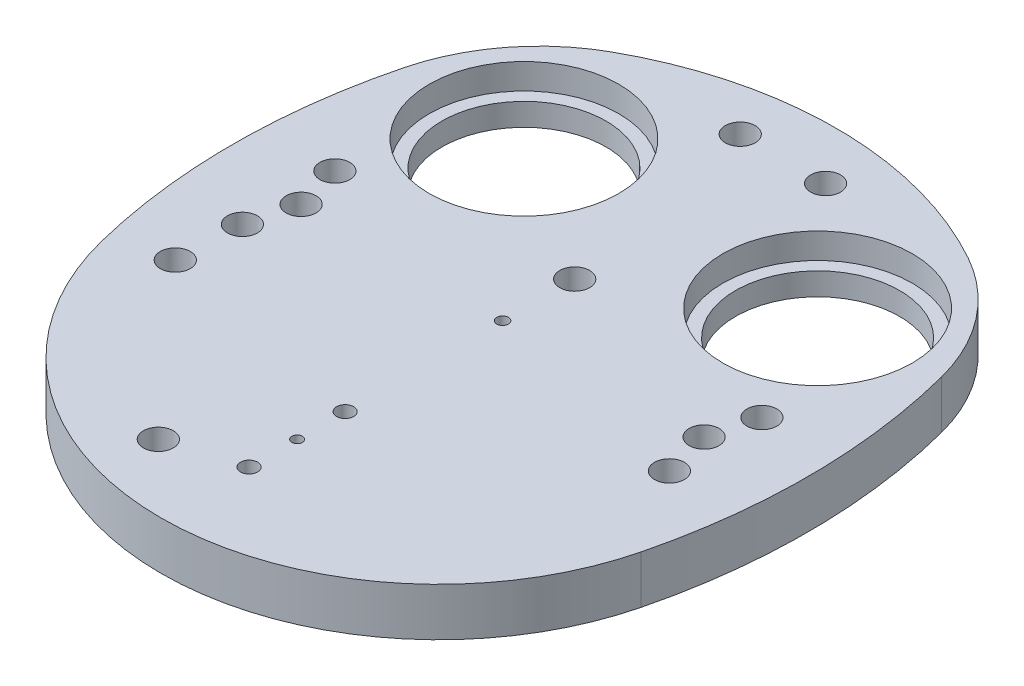
from build123d import *

# Parameters (mm, degrees)
SKETCH1_R                     = 20
SKETCH1_R_2                   = 17.75
BOSS_EXTRUDE1_DEPTH           = 9
SKETCH2_R                     = 17.75
SKETCH2_R_2                   = 15.375
BOSS_EXTRUDE3_DEPTH           = 4.215
SKETCH4_R                     = 2.8
M3_TAPPING_INSERT_HOLES_DEPTH = 7
EXTRUDE_THIN2_START           = -9
EXTRUDE_THIN2_DEPTH           = 9
THUMB_KNUCKLE_HOLE_START      = -4.5875
SKETCH7_R                     = 15.25
THUMB_KNUCKLE_HOLE_DEPTH      = 106.441707798
SKETCH8_R                     = 1
SKETCH8_R_2                   = 1.6
THUMB_THROUGH_HOLE_S_DEPTH    = 111.029207798
SKETCH9_R                     = 1.1
CENTER_SCREW_THROUGH_DEPTH    = 111.029207798


with BuildPart() as part:
    # Sketch1 → Boss-Extrude1 (new body)
    # profile 1 of 3: a face of its own
    with BuildSketch(Plane(origin=(0, 0, 0), x_dir=(1, 0, 0), z_dir=(0, 1, 0))):
        with BuildLine():
            ThreePointArc((46.554987721, 6.075149623), (47.262334812, 3.074105201), (47.5, 0))
            ThreePointArc((47.5, 0), (9.667891023, -9.056262443), (39.298411056, 16.149225881))
            ThreePointArc((39.298411056, 16.149225881), (0, 28.975470321), (-39.298411056, 16.149225881))
            ThreePointArc((-39.298411056, 16.149225881), (-18.443737557, 17.832108977), (-7.5, 0))
            ThreePointArc((-7.5, 0), (-30.574105201, -19.762334812), (-46.554987721, 6.075149623))
            ThreePointArc((-46.554987721, 6.075149623), (-51.83640533, -24.60085732), (-48.549912051, -55.554205053))
            ThreePointArc((-48.549912051, -55.554205053), (0, -93.502323139), (48.549912051, -55.554205053))
            ThreePointArc((48.549912051, -55.554205053), (51.83640533, -24.60085732), (46.554987721, 6.075149623))
        make_face()
    # profile 2 of 3: a face of its own
    with BuildSketch(Plane(origin=(0, 0, 0), x_dir=(1, 0, 0), z_dir=(0, 1, 0))):
        with Locations((-27.5, 0)):
            Circle(SKETCH1_R)
        with Locations(Location((-27.5, 0, 0), (0, 0, 270))):
            Circle(SKETCH1_R_2, mode=Mode.SUBTRACT)
    # profile 3 of 3: a face of its own
    with BuildSketch(Plane(origin=(0, 0, 0), x_dir=(1, 0, 0), z_dir=(0, 1, 0))):
        with Locations((27.5, 0)):
            Circle(SKETCH1_R)
        with Locations(Location((27.5, 0, 0), (0, 0, 270))):
            Circle(SKETCH1_R_2, mode=Mode.SUBTRACT)
    extrude(amount=BOSS_EXTRUDE1_DEPTH)

    # Sketch2 → Boss-Extrude3 (add)
    # profile 1 of 2: a face of its own
    with BuildSketch(Plane(origin=(0, 0, 0), x_dir=(1, 0, 0), z_dir=(0, 1, 0))):
        with Locations(Location((-27.5, 0, 0), (0, 0, 270))):
            Circle(SKETCH2_R)
        with Locations(Location((-27.5, 0, 0), (0, 0, 270))):
            Circle(SKETCH2_R_2, mode=Mode.SUBTRACT)
    # profile 2 of 2: a face of its own
    with BuildSketch(Plane(origin=(0, 0, 0), x_dir=(1, 0, 0), z_dir=(0, 1, 0))):
        with Locations(Location((27.5, 0, 0), (0, 0, 270))):
            Circle(SKETCH2_R)
        with Locations(Location((27.5, 0, 0), (0, 0, 270))):
            Circle(SKETCH2_R_2, mode=Mode.SUBTRACT)
    extrude(amount=BOSS_EXTRUDE3_DEPTH)

    # Sketch4 → M3_Tapping_Insert_Holes (cut)
    with BuildSketch(Plane(origin=(0, 9, 0), x_dir=(1, 0, 0), z_dir=(0, 1, 0))):
        with Locations(Location((-8, 21.01, 0), (0, 0, 270))):
            Circle(SKETCH4_R)
        with Locations(Location((0, -18, 0), (0, 0, 270))):
            Circle(SKETCH4_R)
        with Locations(Location((-40, -22.9303, 0), (0, 0, 270))):
            Circle(SKETCH4_R)
        with Locations(Location((-37.75, -31.5038, 0), (0, 0, 270))):
            Circle(SKETCH4_R)
        with Locations(Location((-40, -40.255, 0), (0, 0, 270))):
            Circle(SKETCH4_R)
        with Locations(Location((-40.5, -52.3285, 0), (0, 0, 270))):
            Circle(SKETCH4_R)
        with Locations(Location((-13, -83, 0), (0, 0, 270))):
            Circle(SKETCH4_R)
        with Locations(Location((40, -40.255, 0), (0, 0, 90))):
            Circle(SKETCH4_R)
        with Locations(Location((37.75, -31.5038, 0), (0, 0, 90))):
            Circle(SKETCH4_R)
        with Locations(Location((40, -22.9303, 0), (0, 0, 90))):
            Circle(SKETCH4_R)
        with Locations(Location((8, 21.01, 0), (0, 0, 90))):
            Circle(SKETCH4_R)
    extrude(amount=-M3_TAPPING_INSERT_HOLES_DEPTH, mode=Mode.SUBTRACT)

    # Sketch5 → Extrude-Thin2 (add)
    with BuildSketch(Plane(origin=(0, 9, 0), x_dir=(1, 0, 0), z_dir=(0, 1, 0)).offset(EXTRUDE_THIN2_START)):
        with BuildLine():
            ThreePointArc((-50.490710842, -56.037216511), (-53.894544169, -27.770971196), (-50.251676697, 0.465463106))
            ThreePointArc((-50.251676697, 0.465463106), (-44.064896745, 13.114076138), (-33.394207534, 22.301026099))
            ThreePointArc((-33.394207534, 22.301026099), (0, 30.975470321), (33.394207534, 22.301026099))
            ThreePointArc((33.394207534, 22.301026099), (44.064896745, 13.114076138), (50.251676697, 0.465463106))
            ThreePointArc((50.251676697, 0.465463106), (53.894544169, -27.770971196), (50.490710842, -56.037216511))
            ThreePointArc((50.490710842, -56.037216511), (0, -95.502323157), (-50.490710842, -56.037216511))
        make_face()
        with BuildLine():
            ThreePointArc((-48.549912048, -55.554205085), (-51.894562065, -27.779432105), (-48.315034049, -0.033951806))
            ThreePointArc((-48.315034049, -0.033951806), (-42.481784381, 11.891883339), (-32.420848839, 20.55386473))
            ThreePointArc((-32.420848839, 20.55386473), (0, 28.975470321), (32.420848839, 20.55386473))
            ThreePointArc((32.420848839, 20.55386473), (42.481784381, 11.891883339), (48.315034049, -0.033951806))
            ThreePointArc((48.315034049, -0.033951806), (51.894562065, -27.779432105), (48.549912048, -55.554205085))
            ThreePointArc((48.549912048, -55.554205085), (0, -93.502323157), (-48.549912048, -55.554205085))
        make_face(mode=Mode.SUBTRACT)
    extrude(amount=EXTRUDE_THIN2_DEPTH)

    # Sketch7 → Thumb_Knuckle_Hole (cut, through all)
    with BuildSketch(Plane(origin=(0, 9, 0), x_dir=(1, 0, 0), z_dir=(0, 1, 0)).offset(THUMB_KNUCKLE_HOLE_START)):
        with Locations(Location((0, -70, 0), (0, 0, 270))):
            Circle(SKETCH7_R)
    extrude(amount=-THUMB_KNUCKLE_HOLE_DEPTH, mode=Mode.SUBTRACT)

    # Sketch8 → Thumb_Through_Hole(s) (cut, through all)
    with BuildSketch(Plane(origin=(0, 9, 0), x_dir=(1, 0, 0), z_dir=(0, 1, 0))):
        with Locations(Location((0, -70, 0), (0, 0, 270))):
            Circle(SKETCH8_R)
        with Locations(Location((0, -61, 0), (0, 0, 270))):
            Circle(SKETCH8_R_2)
        with Locations(Location((0, -79, 0), (0, 0, 270))):
            Circle(SKETCH8_R_2)
    extrude(amount=-THUMB_THROUGH_HOLE_S_DEPTH, mode=Mode.SUBTRACT)

    # Sketch9 → Center_Screw_Through (cut, through all)
    with BuildSketch(Plane(origin=(0, 9, 0), x_dir=(1, 0, 0), z_dir=(0, 1, 0))):
        with Locations(Location((0, -31.5037951, 0), (0, 0, 270))):
            Circle(SKETCH9_R)
    extrude(amount=-CENTER_SCREW_THROUGH_DEPTH, mode=Mode.SUBTRACT)


solid = part.part
